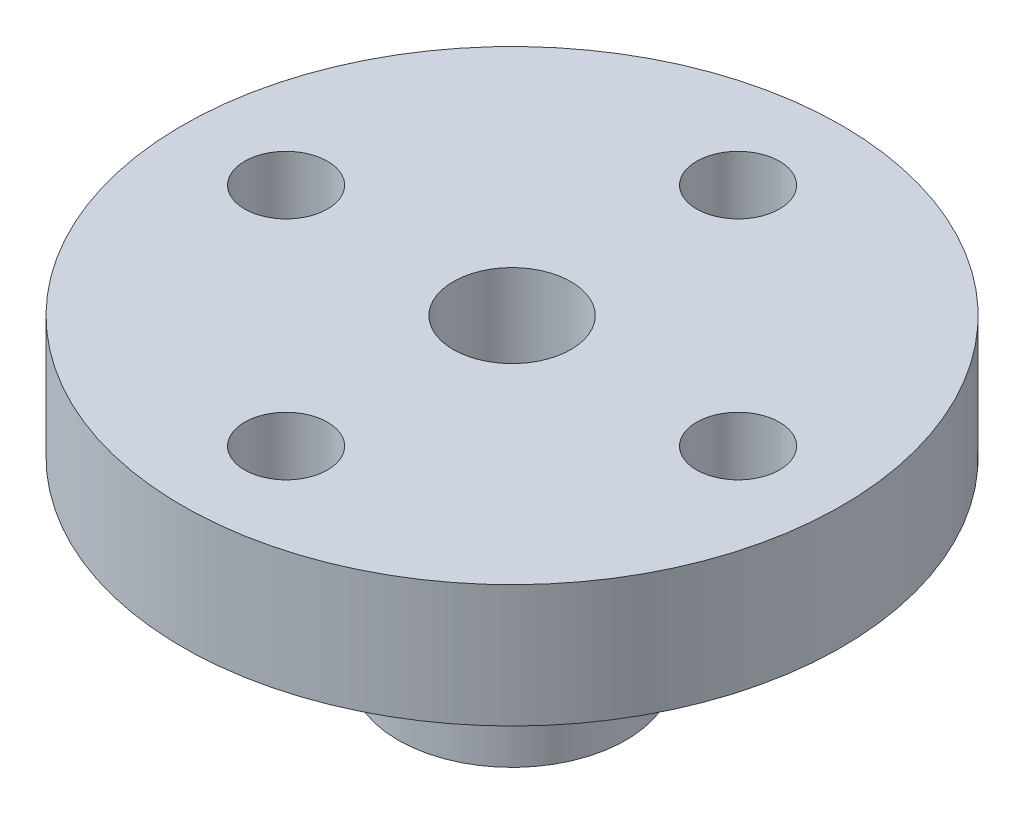
from build123d import *

# Parameters (mm, degrees)
SKETCH1_R                      = 6.05
SKETCH1_R_2                    = 3.05
BOSS_EXTRUDE1_DEPTH            = 10
SKETCH2_R                      = 17.5
BOSS_EXTRUDE2_DEPTH            = 6.5
CUT_EXTRUDE1_REACH             = 28.693
SKETCH3_R                      = 2.2
CUT_EXTRUDE2_DEPTH             = 30.744747435
CUT_EXTRUDE2_DEPTH_BACK        = 30.744747435
SKETCH4_R                      = 1.5
CUT_EXTRUDE3_REACH             = 28.693
SKETCH6_R                      = 3.125
CUT_EXTRUDE3_DIRECTION_2_REACH = 28.693


with BuildPart() as part:
    # Sketch1 → Boss-Extrude1 (new body)
    with BuildSketch(Plane(origin=(0, 0, 0), x_dir=(1, 0, 0), z_dir=(0, 1, 0))):
        with Locations(Location((0, 0, 0), (0, 0, 270))):
            Circle(SKETCH1_R)
        with Locations(Location((0, 0, 0), (0, 0, 270))):
            Circle(SKETCH1_R_2, mode=Mode.SUBTRACT)
    extrude(amount=BOSS_EXTRUDE1_DEPTH)

    # Sketch2 → Boss-Extrude2 (add)
    with BuildSketch(Plane(origin=(0, 10, 0), x_dir=(1, 0, 0), z_dir=(0, 1, 0))):
        with Locations(Location((0, 0, 0), (0, 0, 90))):
            Circle(SKETCH2_R)
    extrude(amount=BOSS_EXTRUDE2_DEPTH)

    # Sketch3 → Cut-Extrude1 (cut, up to next)
    with BuildSketch(Plane.XZ.offset(-10), mode=Mode.PRIVATE) as cut_extrude1_sk1:
        with Locations(Location((12, 0, 0), (0, 0, 270))):
            Circle(SKETCH3_R)
    cut_extrude1_tool1 = extrude(cut_extrude1_sk1.sketch, amount=-CUT_EXTRUDE1_REACH, mode=Mode.PRIVATE) & part.part
    # Sketch3 → Cut-Extrude1 (cut, up to next)
    with BuildSketch(Plane.XZ.offset(-10), mode=Mode.PRIVATE) as cut_extrude1_sk2:
        with Locations(Location((0, -12, 0), (0, 0, 270))):
            Circle(SKETCH3_R)
    cut_extrude1_tool2 = extrude(cut_extrude1_sk2.sketch, amount=-CUT_EXTRUDE1_REACH, mode=Mode.PRIVATE) & part.part
    # Sketch3 → Cut-Extrude1 (cut, up to next)
    with BuildSketch(Plane.XZ.offset(-10), mode=Mode.PRIVATE) as cut_extrude1_sk3:
        with Locations(Location((-12, 0, 0), (0, 0, 270))):
            Circle(SKETCH3_R)
    cut_extrude1_tool3 = extrude(cut_extrude1_sk3.sketch, amount=-CUT_EXTRUDE1_REACH, mode=Mode.PRIVATE) & part.part
    # Sketch3 → Cut-Extrude1 (cut, up to next)
    with BuildSketch(Plane.XZ.offset(-10), mode=Mode.PRIVATE) as cut_extrude1_sk4:
        with Locations(Location((0, 12, 0), (0, 0, 270))):
            Circle(SKETCH3_R)
    cut_extrude1_tool4 = extrude(cut_extrude1_sk4.sketch, amount=-CUT_EXTRUDE1_REACH, mode=Mode.PRIVATE) & part.part
    add(cut_extrude1_tool1.solids().sort_by_distance((12, 10, 0))[0], mode=Mode.SUBTRACT)
    add(cut_extrude1_tool2.solids().sort_by_distance((0, 10, -12))[0], mode=Mode.SUBTRACT)
    add(cut_extrude1_tool3.solids().sort_by_distance((-12, 10, 0))[0], mode=Mode.SUBTRACT)
    add(cut_extrude1_tool4.solids().sort_by_distance((0, 10, 12))[0], mode=Mode.SUBTRACT)

    # Sketch4 → Cut-Extrude2 (cut, two sides: drawn at the far end of the back side and taken through both)
    with BuildSketch(Plane(origin=(0, 0, 0), x_dir=(0, 0, -1), z_dir=(1, 0, 0)).offset(-CUT_EXTRUDE2_DEPTH_BACK)):
        with Locations((0, 4.916404418)):
            Circle(SKETCH4_R)
    extrude(amount=CUT_EXTRUDE2_DEPTH + CUT_EXTRUDE2_DEPTH_BACK, mode=Mode.SUBTRACT)

    # Sketch6 → Cut-Extrude3 (cut, up to next)
    with BuildSketch(Plane(origin=(0, 10, 0), x_dir=(-1, 0, 0), z_dir=(0, -1, 0)), mode=Mode.PRIVATE) as cut_extrude3_sk1:
        with Locations(Location((0, 0, 0), (0, 0, 270))):
            Circle(SKETCH6_R)
    cut_extrude3_tool1 = extrude(cut_extrude3_sk1.sketch, amount=-CUT_EXTRUDE3_REACH, mode=Mode.PRIVATE) & part.part
    add(cut_extrude3_tool1.solids().sort_by_distance((0, 10, 0))[0], mode=Mode.SUBTRACT)

    # Sketch6 → Cut-Extrude3 direction 2 (cut, up to next)
    with BuildSketch(Plane(origin=(0, 10, 0), x_dir=(-1, 0, 0), z_dir=(0, -1, 0)), mode=Mode.PRIVATE) as cut_extrude3_direction_2_sk1:
        with Locations(Location((0, 0, 0), (0, 0, 270))):
            Circle(SKETCH6_R)
    cut_extrude3_direction_2_tool1 = extrude(cut_extrude3_direction_2_sk1.sketch, amount=CUT_EXTRUDE3_DIRECTION_2_REACH, mode=Mode.PRIVATE) & part.part
    add(cut_extrude3_direction_2_tool1.solids().sort_by_distance((0, 10, 0))[0], mode=Mode.SUBTRACT)


solid = part.part
